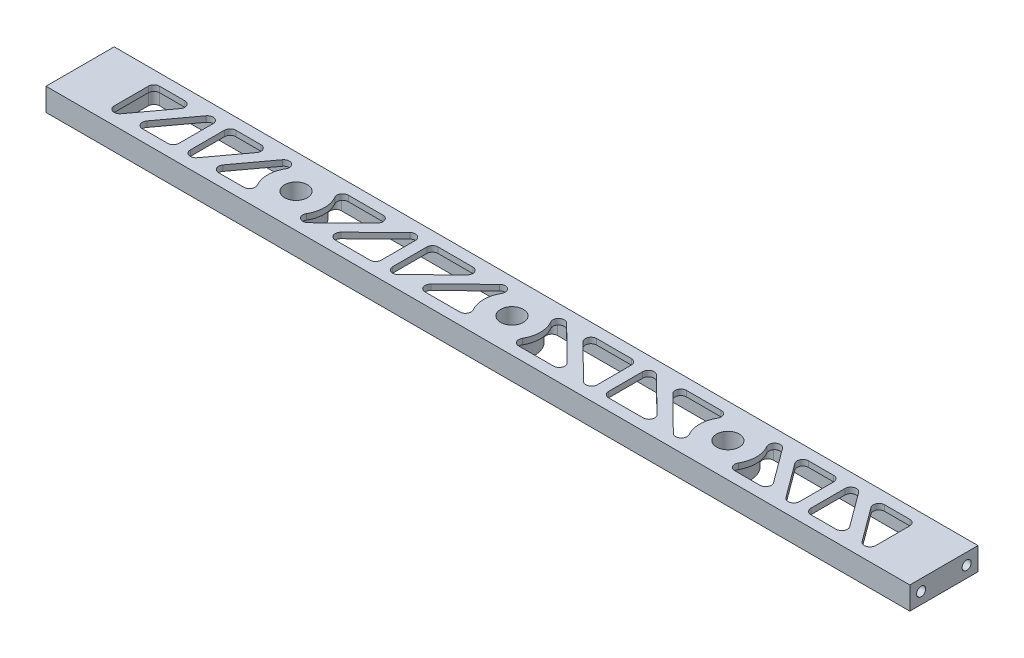
from build123d import *

# Parameters (mm, degrees)
SKETCH1_W                        = 38.1
SKETCH1_H                        = 12.7
BOSS_EXTRUDE1_DEPTH              = 241.3
F_1_4_20_TAPPED_HOLE1_AT_2_COUNT = 2
F_1_4_20_TAPPED_HOLE1_AT_2_PITCH = 25.4
SKETCH2_R                        = 6.35
CUT_EXTRUDE1_DEPTH               = 243.383750487
CUT_EXTRUDE2_DEPTH               = 9.525
CUT_EXTRUDE3_DEPTH               = 243.238143415


with BuildPart() as part:
    # Sketch1 → Boss-Extrude1 (new, symmetric)
    with BuildSketch(Plane(origin=(0, 0, 0), x_dir=(0, 0, -1), z_dir=(1, 0, 0))):
        Rectangle(SKETCH1_W, SKETCH1_H)
    extrude(amount=BOSS_EXTRUDE1_DEPTH, both=True)

    # Sketch3 → 1/4-20 Tapped Hole1 (revolve, cut)
    with BuildSketch(Plane(origin=(241.3, 0, 12.7), x_dir=(0, 0, -1), z_dir=(0, 1, 0))):
        Polygon((0, 0), (0, 20.583816902), (2.5527, 19.05), (2.5527, 0), align=None)
    f_1_4_20_tapped_hole1 = revolve(axis=Axis((247.65, 0, 12.7), (-1, 0, 0)), mode=Mode.SUBTRACT)

    # 1/4-20 Tapped Hole1 at 2: 1/4-20 Tapped Hole1 ×2
    with Locations(*[(0, 0, -i * F_1_4_20_TAPPED_HOLE1_AT_2_PITCH) for i in range(1, F_1_4_20_TAPPED_HOLE1_AT_2_COUNT)]):
        add(f_1_4_20_tapped_hole1, mode=Mode.SUBTRACT)

    # Sketch2 → Cut-Extrude1 (cut, through all)
    with BuildSketch(Plane(origin=(0, 6.35, 0), x_dir=(1, 0, 0), z_dir=(0, 1, 0))):
        with Locations(Location((0, 0, 0), (0, 0, 270))):
            Circle(SKETCH2_R)
        with Locations(Location((120.65, 0, 0), (0, 0, 270))):
            Circle(SKETCH2_R)
    cut_extrude1 = extrude(amount=-CUT_EXTRUDE1_DEPTH, mode=Mode.SUBTRACT)

    # Sketch4 → Cut-Extrude2 (cut)
    with BuildSketch(Plane.XZ.offset(6.35)):
        with BuildLine():
            Line((9.525, 15.875), (111.125, 15.875))
            ThreePointArc((111.125, 15.875), (114.137069471, 13.704023157), (113.03, 10.16))
            ThreePointArc((113.03, 10.16), (107.95, 0), (113.03, -10.16))
            ThreePointArc((113.03, -10.16), (114.137069471, -13.704023157), (111.125, -15.875))
            Line((111.125, -15.875), (9.525, -15.875))
            ThreePointArc((9.525, -15.875), (6.512930529, -13.704023157), (7.62, -10.16))
            ThreePointArc((7.62, -10.16), (12.7, 0), (7.62, 10.16))
            ThreePointArc((7.62, 10.16), (6.512930529, 13.704023157), (9.525, 15.875))
        make_face()
        with BuildLine():
            Line((130.175, 15.875), (212.725, 15.875))
            ThreePointArc((212.725, 15.875), (214.97006403, 14.94506403), (215.9, 12.7))
            Line((215.9, 12.7), (215.9, -12.7))
            ThreePointArc((215.9, -12.7), (214.97006403, -14.94506403), (212.725, -15.875))
            Line((212.725, -15.875), (130.175, -15.875))
            ThreePointArc((130.175, -15.875), (127.162930529, -13.704023157), (128.27, -10.16))
            ThreePointArc((128.27, -10.16), (133.35, 0), (128.27, 10.16))
            ThreePointArc((128.27, 10.16), (127.162930529, 13.704023157), (130.175, 15.875))
        make_face()
    cut_extrude2 = extrude(amount=-CUT_EXTRUDE2_DEPTH, mode=Mode.SUBTRACT)

    # Mirror2: 1/4-20 Tapped Hole1, Cut-Extrude1, Cut-Extrude2 across plane
    add(f_1_4_20_tapped_hole1.mirror(Plane(origin=(0, 0, 0), x_dir=(0, 0, 1), z_dir=(1, 0, 0))), mode=Mode.SUBTRACT)
    add(cut_extrude1.mirror(Plane(origin=(0, 0, 0), x_dir=(0, 0, 1), z_dir=(1, 0, 0))), mode=Mode.SUBTRACT)
    add(cut_extrude2.mirror(Plane(origin=(0, 0, 0), x_dir=(0, 0, 1), z_dir=(1, 0, 0))), mode=Mode.SUBTRACT)

    # Mirror2 copy 1 sketch → Mirror2 copy 1 (revolve, cut)
    with BuildSketch(Plane(origin=(-241.3, 0, -12.7), x_dir=(0, 0, -1), z_dir=(0, 1, 0))):
        Polygon((0, 0), (0, -20.583816902), (2.5527, -19.05), (2.5527, 0), align=None)
    revolve(axis=Axis((-247.65, 0, -12.7), (-1, 0, 0)), mode=Mode.SUBTRACT)

    # Sketch5 → Cut-Extrude3 (cut, through all)
    with BuildSketch(Plane.XZ.offset(-3.175)):
        with BuildLine():
            Line((-212.725, 9.525), (-212.725, -9.525))
            ThreePointArc((-212.725, -9.525), (-211.79506403, -11.77006403), (-209.55, -12.7))
            Line((-209.55, -12.7), (-195.485242114, -12.7))
            ThreePointArc((-195.485242114, -12.7), (-192.650798466, -10.955578277), (-192.930978485, -7.639168005))
            Line((-192.930978485, -7.639168005), (-206.995736371, 11.410831995))
            ThreePointArc((-206.995736371, 11.410831995), (-210.542682723, 12.540825925), (-212.725, 9.525))
        make_face()
        with BuildLine():
            Line((-193.763649857, 12.7), (-179.698891971, 12.7))
            ThreePointArc((-179.698891971, 12.7), (-177.453827941, 11.77006403), (-176.523891971, 9.525))
            Line((-176.523891971, 9.525), (-176.523891971, -9.525))
            ThreePointArc((-176.523891971, -9.525), (-178.706209248, -12.540825925), (-182.2531556, -11.410831995))
            Line((-182.2531556, -11.410831995), (-196.317913486, 7.639168005))
            ThreePointArc((-196.317913486, 7.639168005), (-196.598093505, 10.955578277), (-193.763649857, 12.7))
        make_face()
        with BuildLine():
            Line((-170.173891971, 9.525), (-170.173891971, -9.525))
            ThreePointArc((-170.173891971, -9.525), (-169.243956001, -11.77006403), (-166.998891971, -12.7))
            Line((-166.998891971, -12.7), (-152.934134085, -12.7))
            ThreePointArc((-152.934134085, -12.7), (-150.099690437, -10.955578277), (-150.379870456, -7.639168005))
            Line((-150.379870456, -7.639168005), (-164.444628342, 11.410831995))
            ThreePointArc((-164.444628342, 11.410831995), (-167.991574695, 12.540825925), (-170.173891971, 9.525))
        make_face()
        with BuildLine():
            Line((-151.212541828, 12.7), (-137.147783942, 12.7))
            ThreePointArc((-137.147783942, 12.7), (-134.398153285, 11.1125), (-134.398153285, 7.9375))
            ThreePointArc((-134.398153285, 7.9375), (-136.525, 0), (-134.398153285, -7.9375))
            ThreePointArc((-134.398153285, -7.9375), (-135.408372876, -12.181138954), (-139.702047571, -11.410831995))
            Line((-139.702047571, -11.410831995), (-153.766805457, 7.639168005))
            ThreePointArc((-153.766805457, 7.639168005), (-154.046985476, 10.955578277), (-151.212541828, 12.7))
        make_face()
        with BuildLine():
            Line((-104.152216058, -12.7), (-84.785451907, -12.7))
            ThreePointArc((-84.785451907, -12.7), (-81.847150244, -10.727916595), (-82.558975163, -7.261501313))
            Line((-82.558975163, -7.261501313), (-101.925739314, 11.788498687))
            ThreePointArc((-101.925739314, 11.788498687), (-106.095401645, 12.035907161), (-106.901846715, 7.9375))
            ThreePointArc((-106.901846715, 7.9375), (-104.775, 0), (-106.901846715, -7.9375))
            ThreePointArc((-106.901846715, -7.9375), (-106.901846715, -11.1125), (-104.152216058, -12.7))
        make_face()
        with BuildLine():
            Line((-86.04176415, 12.7), (-66.675, 12.7))
            ThreePointArc((-66.675, 12.7), (-64.42993597, 11.77006403), (-63.5, 9.525))
            Line((-63.5, 9.525), (-63.5, -9.525))
            ThreePointArc((-63.5, -9.525), (-65.44789745, -12.453283513), (-68.901476744, -11.788498687))
            Line((-68.901476744, -11.788498687), (-88.268240895, 7.261501313))
            ThreePointArc((-88.268240895, 7.261501313), (-88.980065814, 10.727916595), (-86.04176415, 12.7))
        make_face()
        with BuildLine():
            Line((-57.15, 9.525), (-57.15, -9.525))
            ThreePointArc((-57.15, -9.525), (-56.22006403, -11.77006403), (-53.975, -12.7))
            Line((-53.975, -12.7), (-34.60823585, -12.7))
            ThreePointArc((-34.60823585, -12.7), (-31.669934186, -10.727916595), (-32.381759105, -7.261501313))
            Line((-32.381759105, -7.261501313), (-51.748523256, 11.788498687))
            ThreePointArc((-51.748523256, 11.788498687), (-55.20210255, 12.453283513), (-57.15, 9.525))
        make_face()
        with BuildLine():
            Line((-38.091024837, 7.261501313), (-18.724260686, -11.788498687))
            ThreePointArc((-18.724260686, -11.788498687), (-14.554598355, -12.035907161), (-13.748153285, -7.9375))
            ThreePointArc((-13.748153285, -7.9375), (-15.875, 0), (-13.748153285, 7.9375))
            ThreePointArc((-13.748153285, 7.9375), (-13.748153285, 11.1125), (-16.497783942, 12.7))
            Line((-16.497783942, 12.7), (-35.864548093, 12.7))
            ThreePointArc((-35.864548093, 12.7), (-38.802849756, 10.727916595), (-38.091024837, 7.261501313))
        make_face()
    cut_extrude3 = extrude(amount=-CUT_EXTRUDE3_DEPTH, mode=Mode.SUBTRACT)

    # Mirror3: Cut-Extrude3 across plane
    add(cut_extrude3.mirror(Plane(origin=(0, 0, 0), x_dir=(0, 0, 1), z_dir=(1, 0, 0))), mode=Mode.SUBTRACT)


solid = part.part
